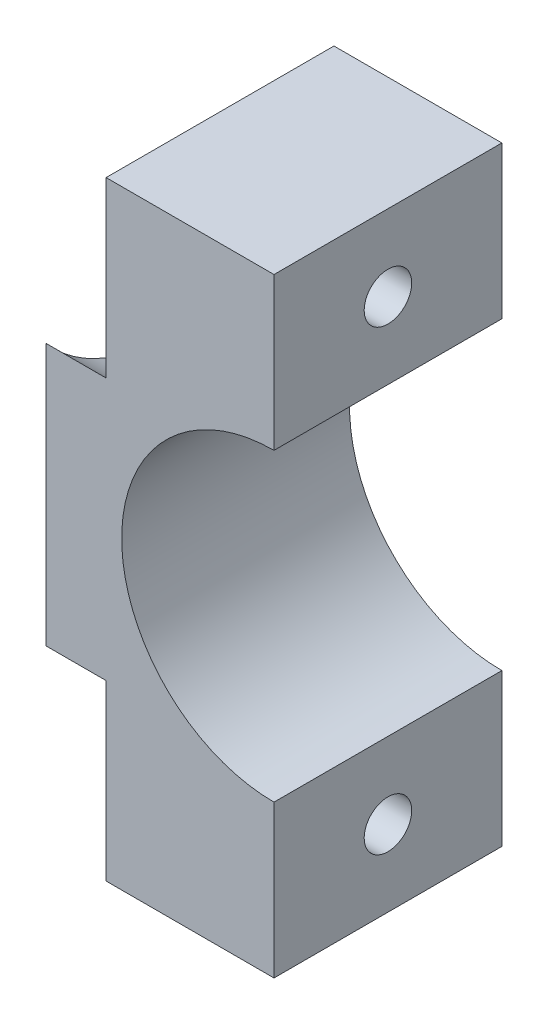
from build123d import *

# Parameters (mm, degrees)
BOSS_EXTRUDE1_DEPTH = 19
SKETCH4_R           = 1.980568965
CUT_EXTRUDE1_DEPTH  = 35.672179049
SKETCH6_R           = 12.5
CUT_EXTRUDE2_DEPTH  = 5


with BuildPart() as part:
    # Sketch2 → Boss-Extrude1 (new body)
    with BuildSketch(Plane(origin=(0, 0, 0), x_dir=(0, 1, 0), z_dir=(0, 0, 1))):
        with BuildLine():
            Line((10.925, 19), (-10.925, 19))
            Line((-10.925, 19), (-10.925, 14))
            Line((-10.925, 14), (-25.4, 14))
            Line((-25.4, 14), (-25.4, 0))
            Line((-25.4, 0), (-12.7, 0))
            ThreePointArc((-12.7, 0), (0, 12.7), (12.7, 0))
            Line((12.7, 0), (25.4, 0))
            Line((25.4, 0), (25.4, 14))
            Line((25.4, 14), (10.925, 14))
            Line((10.925, 14), (10.925, 19))
        make_face()
    extrude(amount=BOSS_EXTRUDE1_DEPTH)

    # Sketch4 → Cut-Extrude1 (cut, through all)
    with BuildSketch(Plane.ZY.offset(14)):
        with Locations((9.5, 19.05)):
            Circle(SKETCH4_R)
        with Locations((9.5, -19.05)):
            Circle(SKETCH4_R)
    extrude(amount=-CUT_EXTRUDE1_DEPTH, mode=Mode.SUBTRACT)

    # Sketch6 → Cut-Extrude2 (cut)
    with BuildSketch(Plane(origin=(-19, 0, 0), x_dir=(0, -1, 0), z_dir=(-1, 0, 0))):
        with Locations((-19.05, 9.5)):
            Circle(SKETCH6_R)
        with Locations((19.05, 9.5)):
            Circle(SKETCH6_R)
    extrude(amount=-CUT_EXTRUDE2_DEPTH, mode=Mode.SUBTRACT)


solid = part.part
